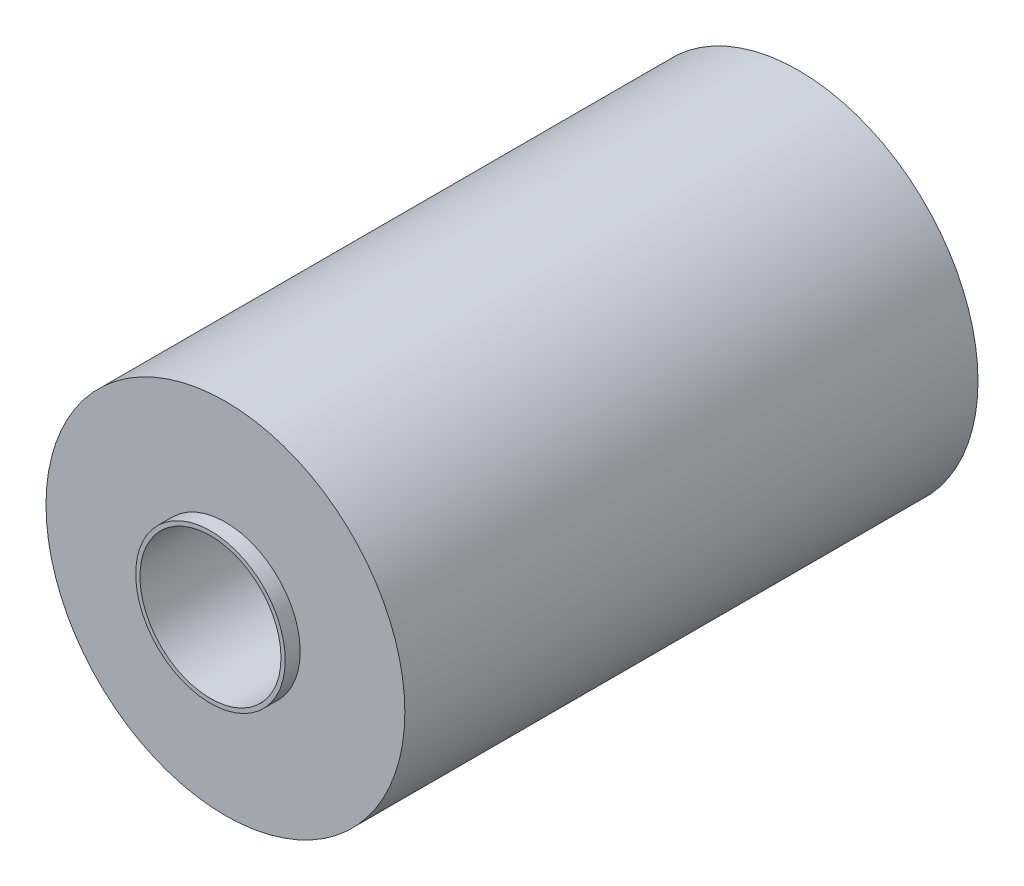
from build123d import *

# Parameters (mm, degrees)
SKETCH_1_R           = 36
SKETCH_1_R_2         = 15
EXTRUDE_1_DEPTH      = 57.5
EXTRUDE_2_DEPTH      = 60.5
EXTRUDE_2_DEPTH_BACK = 57.5
SKETCH_2_R           = 15
SKETCH_2_R_2         = 14.15


with BuildPart() as part:
    # 草图1 → 凸台-拉伸1 (new, symmetric)
    with BuildSketch(Plane.XY):
        Circle(SKETCH_1_R)
        Circle(SKETCH_1_R_2, mode=Mode.SUBTRACT)
    extrude(amount=EXTRUDE_1_DEPTH, both=True)


with BuildPart() as body_2:
    # 草图2 → 凸台-拉伸2 (new, two sides: drawn at the far end of the back side and taken through both)
    with BuildSketch(Plane.XY.offset(-EXTRUDE_2_DEPTH_BACK)):
        Circle(SKETCH_2_R)
        Circle(SKETCH_2_R_2, mode=Mode.SUBTRACT)
    extrude(amount=EXTRUDE_2_DEPTH + EXTRUDE_2_DEPTH_BACK)


solid = Compound([part.part, body_2.part])
